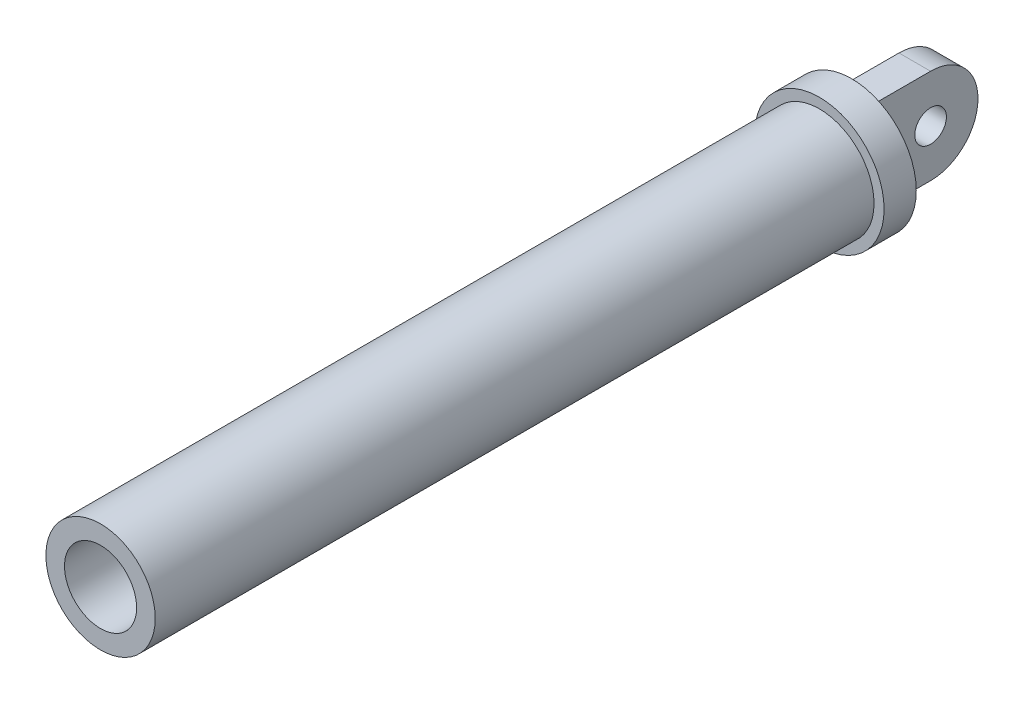
from build123d import *

# Parameters (mm, degrees)
SKETCH1_R           = 5
BOSS_EXTRUDE1_DEPTH = 5


with BuildPart() as part:
    # Sketch1 → Boss-Extrude1 (new, symmetric)
    with BuildSketch(Plane(origin=(0, 0, 0), x_dir=(0, 0, -1), z_dir=(1, 0, 0))):
        with BuildLine():
            Line((0, -15), (-20, -15))
            Line((-20, -15), (-20, 15))
            Line((-20, 15), (0, 15))
            ThreePointArc((0, 15), (15, 0), (0, -15))
        make_face()
        Circle(SKETCH1_R, mode=Mode.SUBTRACT)
    extrude(amount=BOSS_EXTRUDE1_DEPTH, both=True)

    # Sketch2 → Revolve1 (revolve)
    with BuildSketch(Plane(origin=(0, 0, 0), x_dir=(0, 0, -1), z_dir=(1, 0, 0)), mode=Mode.PRIVATE) as revolve1_sk:
        Polygon((-20, 0), (-20, 20.474587648), (-30.174617149, 20.474587648), (-30.174617149, 17.289208906), (-257.531045689, 17.289208906), (-257.531045689, 11.408509691), (-34.338293907, 11.408509691), (-34.338293907, 0), align=None)
    revolve(revolve1_sk.sketch.rotate(Axis((0, 0, 34.338293907), (0, 0, -1)), 90), axis=Axis((0, 0, 34.338293907), (0, 0, -1)))


solid = part.part
